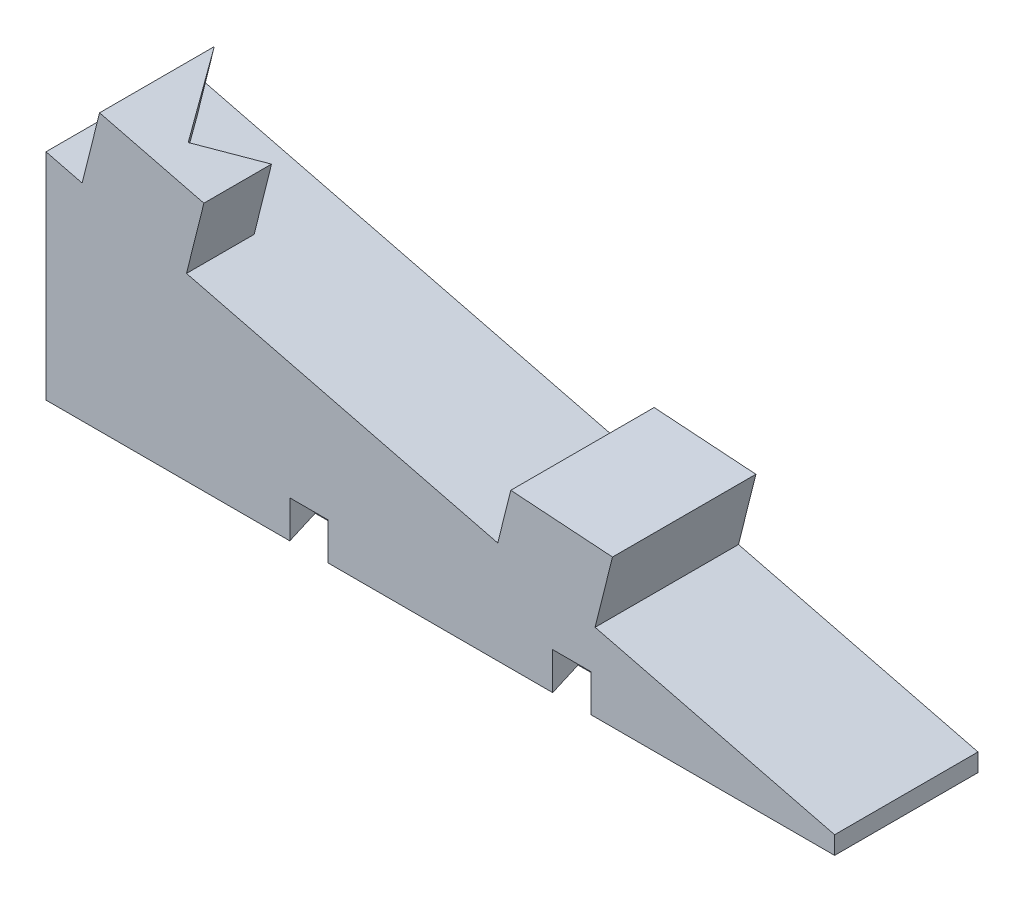
from build123d import *

# Parameters (mm, degrees)
BOSS_EXTRUDE1_DEPTH      = 10
BOSS_EXTRUDE1_DEPTH_BACK = 10
SKETCH2_W                = 14
SKETCH2_H                = 20
BOSS_EXTRUDE2_DEPTH      = 10
CUT_EXTRUDE1_DEPTH       = 5.2
CUT_EXTRUDE2_DEPTH       = 20


with BuildPart() as part:
    # Sketch1 → Boss-Extrude1 (new, two sides: drawn at the far end of the back side and taken through both)
    with BuildSketch(Plane.XY.offset(-BOSS_EXTRUDE1_DEPTH_BACK)):
        Polygon((-55, 21.875), (55, -5.625), (55, -8.125), (-55, -8.125), align=None)
    extrude(amount=BOSS_EXTRUDE1_DEPTH + BOSS_EXTRUDE1_DEPTH_BACK)

    # Sketch2 → Boss-Extrude2 (add)
    with BuildSketch(Plane(origin=(1.911764706, 7.647058824, 0), x_dir=(0.970142500145332, -0.24253562503633289, 0), z_dir=(0.24253562503633289, 0.970142500145332, 0))):
        Polygon((-53.463304306, -10), (-38.463304306, -10), (-38.463304306, -0.564895404), (-45.408034785, -5.450442479), (-53.463304306, 6), align=None)
        with Locations((13.286695694, 0)):
            Rectangle(SKETCH2_W, SKETCH2_H)
    extrude(amount=BOSS_EXTRUDE2_DEPTH)

    # Sketch3 → Cut-Extrude1 (cut)
    with BuildSketch(Plane.XZ.offset(8.125)):
        Polygon((15.692093342, 10.058542854), (14.11294757, 4.9), (22.553719096, 4.9), (20.974573324, 10.058542854), align=None)
        Polygon((-20.974573324, 10.058542854), (-22.553719096, 4.9), (-14.11294757, 4.9), (-15.692093342, 10.058542854), align=None)
    extrude(amount=-CUT_EXTRUDE1_DEPTH, mode=Mode.SUBTRACT)

    # Sketch4 → Cut-Extrude2 (cut)
    with BuildSketch(Plane.XY.offset(10)):
        Polygon((9.829772572, 13.398379905), (10.436111635, 15.823736155), (24.018106637, 12.428237405), align=None)
    extrude(amount=-CUT_EXTRUDE2_DEPTH, mode=Mode.SUBTRACT)


solid = part.part
